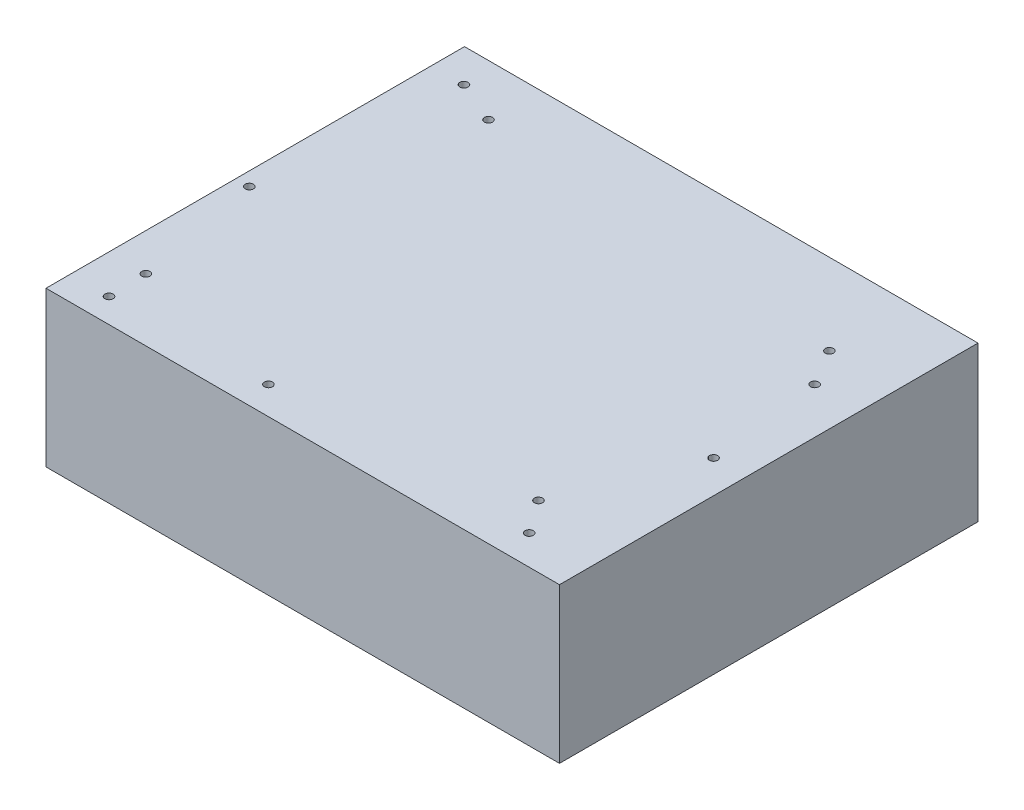
from build123d import *

# Parameters (mm, degrees)
BOSS_EXTRUDE1_DEPTH = 113.03
A_ARM_SKETCHES_R    = 3
A_ARM_HOLES_DEPTH   = 20


with BuildPart() as part:
    # Sketch1 → Boss-Extrude1 (new body)
    with BuildSketch(Plane(origin=(0, 0, 0), x_dir=(1, 0, 0), z_dir=(0, 1, 0))):
        Polygon((-187.5, 150), (-187.5, 170), (187.5, 170), (187.5, 152.769842226), (187.5, -135.642424533), (-187.5, -135.642424533), align=None)
    extrude(amount=BOSS_EXTRUDE1_DEPTH)

    # A-ARM SKETCHES → A-ARM HOLES (cut)
    with BuildSketch(Plane(origin=(0, 113.03, 0), x_dir=(1, 0, 0), z_dir=(0, 1, 0))):
        with Locations(Location((-163.609115423, 145.695818662, 0), (0, 0, 270))):
            Circle(A_ARM_SKETCHES_R)
        with Locations(Location((-132.455839765, 132.467571365, 0), (0, 0, 270))):
            Circle(A_ARM_SKETCHES_R)
        with Locations(Location((-177.54881427, 2.914785745, 0), (0, 0, 270))):
            Circle(A_ARM_SKETCHES_R)
        with Locations(Location((-160.15888427, -90.036396379, 0), (0, 0, 270))):
            Circle(A_ARM_SKETCHES_R)
        with Locations(Location((-159.322465718, -117.822298669, 0), (0, 0, 270))):
            Circle(A_ARM_SKETCHES_R)
        with Locations(Location((-45.450372331, -115.251672549, 0), (0, 0, 270))):
            Circle(A_ARM_SKETCHES_R)
        with Locations(Location((143.753799676, -114.029801923, 0), (0, 0, 270))):
            Circle(A_ARM_SKETCHES_R)
        with Locations(Location((126.54701573, -90.036396379, 0), (0, 0, 270))):
            Circle(A_ARM_SKETCHES_R)
        with Locations(Location((163.603739253, 0.788099457, 0), (0, 0, 270))):
            Circle(A_ARM_SKETCHES_R)
        with Locations(Location((154.009247845, 84.207947628, 0), (0, 0, 270))):
            Circle(A_ARM_SKETCHES_R)
        with Locations(Location((138.154047489, 110.820373833, 0), (0, 0, 270))):
            Circle(A_ARM_SKETCHES_R)
    extrude(amount=-A_ARM_HOLES_DEPTH, mode=Mode.SUBTRACT)


solid = part.part
